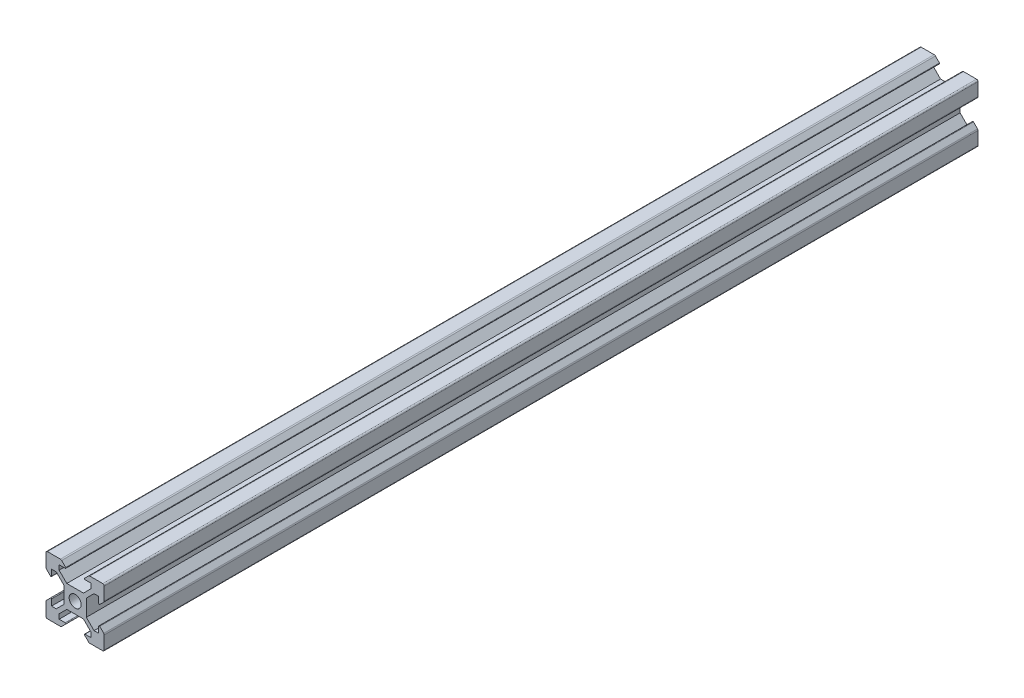
from build123d import *

# Parameters (mm, degrees)
SKETCH1_R           = 2.05
BOSS_EXTRUDE1_DEPTH = 300


with BuildPart() as part:
    # Sketch1 → Boss-Extrude1 (new body)
    with BuildSketch(Plane(origin=(0, 0, 0), x_dir=(0, 1, 0), z_dir=(0, 0, 1))):
        with BuildLine():
            Line((-2.860050506, -3.85), (2.860050506, -3.85))
            Line((2.860050506, -3.85), (5.5, -6.489949494))
            Line((5.5, -6.489949494), (5.5, -8.1))
            Line((5.5, -8.1), (3.382842712, -8.1))
            ThreePointArc((3.382842712, -8.1), (3.198066806, -8.223463314), (3.241421356, -8.441421356))
            Line((3.241421356, -8.441421356), (4.624264069, -9.824264069))
            ThreePointArc((4.624264069, -9.824264069), (4.818918078, -9.95432772), (5.048528137, -10))
            Line((5.048528137, -10), (9.5, -10))
            ThreePointArc((9.5, -10), (9.853553391, -9.853553391), (10, -9.5))
            Line((10, -9.5), (10, -5.048528137))
            ThreePointArc((10, -5.048528137), (9.95432772, -4.818918078), (9.824264069, -4.624264069))
            Line((9.824264069, -4.624264069), (8.441421356, -3.241421356))
            ThreePointArc((8.441421356, -3.241421356), (8.223463314, -3.198066806), (8.1, -3.382842712))
            Line((8.1, -3.382842712), (8.1, -5.5))
            Line((8.1, -5.5), (6.489949494, -5.5))
            Line((6.489949494, -5.5), (3.85, -2.860050506))
            Line((3.85, -2.860050506), (3.85, 2.860050506))
            Line((3.85, 2.860050506), (6.489949494, 5.5))
            Line((6.489949494, 5.5), (8.1, 5.5))
            Line((8.1, 5.5), (8.1, 3.382842712))
            ThreePointArc((8.1, 3.382842712), (8.223463314, 3.198066806), (8.441421356, 3.241421356))
            Line((8.441421356, 3.241421356), (9.824264069, 4.624264069))
            ThreePointArc((9.824264069, 4.624264069), (9.95432772, 4.818918078), (10, 5.048528137))
            Line((10, 5.048528137), (10, 9.5))
            ThreePointArc((10, 9.5), (9.853553391, 9.853553391), (9.5, 10))
            Line((9.5, 10), (5.048528137, 10))
            ThreePointArc((5.048528137, 10), (4.818918078, 9.95432772), (4.624264069, 9.824264069))
            Line((4.624264069, 9.824264069), (3.241421356, 8.441421356))
            ThreePointArc((3.241421356, 8.441421356), (3.198066806, 8.223463314), (3.382842712, 8.1))
            Line((3.382842712, 8.1), (5.5, 8.1))
            Line((5.5, 8.1), (5.5, 6.489949494))
            Line((5.5, 6.489949494), (2.860050506, 3.85))
            Line((2.860050506, 3.85), (-2.860050506, 3.85))
            Line((-2.860050506, 3.85), (-5.5, 6.489949494))
            Line((-5.5, 6.489949494), (-5.5, 8.1))
            Line((-5.5, 8.1), (-3.382842712, 8.1))
            ThreePointArc((-3.382842712, 8.1), (-3.198066806, 8.223463314), (-3.241421356, 8.441421356))
            Line((-3.241421356, 8.441421356), (-4.624264069, 9.824264069))
            ThreePointArc((-4.624264069, 9.824264069), (-4.818918078, 9.95432772), (-5.048528137, 10))
            Line((-5.048528137, 10), (-9.5, 10))
            ThreePointArc((-9.5, 10), (-9.853553391, 9.853553391), (-10, 9.5))
            Line((-10, 9.5), (-10, 5.048528137))
            ThreePointArc((-10, 5.048528137), (-9.95432772, 4.818918078), (-9.824264069, 4.624264069))
            Line((-9.824264069, 4.624264069), (-8.441421356, 3.241421356))
            ThreePointArc((-8.441421356, 3.241421356), (-8.223463314, 3.198066806), (-8.1, 3.382842712))
            Line((-8.1, 3.382842712), (-8.1, 5.5))
            Line((-8.1, 5.5), (-6.489949494, 5.5))
            Line((-6.489949494, 5.5), (-3.85, 2.860050506))
            Line((-3.85, 2.860050506), (-3.85, -2.860050506))
            Line((-3.85, -2.860050506), (-6.489949494, -5.5))
            Line((-6.489949494, -5.5), (-8.1, -5.5))
            Line((-8.1, -5.5), (-8.1, -3.382842712))
            ThreePointArc((-8.1, -3.382842712), (-8.223463314, -3.198066806), (-8.441421356, -3.241421356))
            Line((-8.441421356, -3.241421356), (-9.824264069, -4.624264069))
            ThreePointArc((-9.824264069, -4.624264069), (-9.95432772, -4.818918078), (-10, -5.048528137))
            Line((-10, -5.048528137), (-10, -9.5))
            ThreePointArc((-10, -9.5), (-9.853553391, -9.853553391), (-9.5, -10))
            Line((-9.5, -10), (-5.048528137, -10))
            ThreePointArc((-5.048528137, -10), (-4.818918078, -9.95432772), (-4.624264069, -9.824264069))
            Line((-4.624264069, -9.824264069), (-3.241421356, -8.441421356))
            ThreePointArc((-3.241421356, -8.441421356), (-3.198066806, -8.223463314), (-3.382842712, -8.1))
            Line((-3.382842712, -8.1), (-5.5, -8.1))
            Line((-5.5, -8.1), (-5.5, -6.489949494))
            Line((-5.5, -6.489949494), (-2.860050506, -3.85))
        make_face()
        with Locations(Location((0, 0, 0), (0, 0, 270))):
            Circle(SKETCH1_R, mode=Mode.SUBTRACT)
    extrude(amount=BOSS_EXTRUDE1_DEPTH)


solid = part.part
